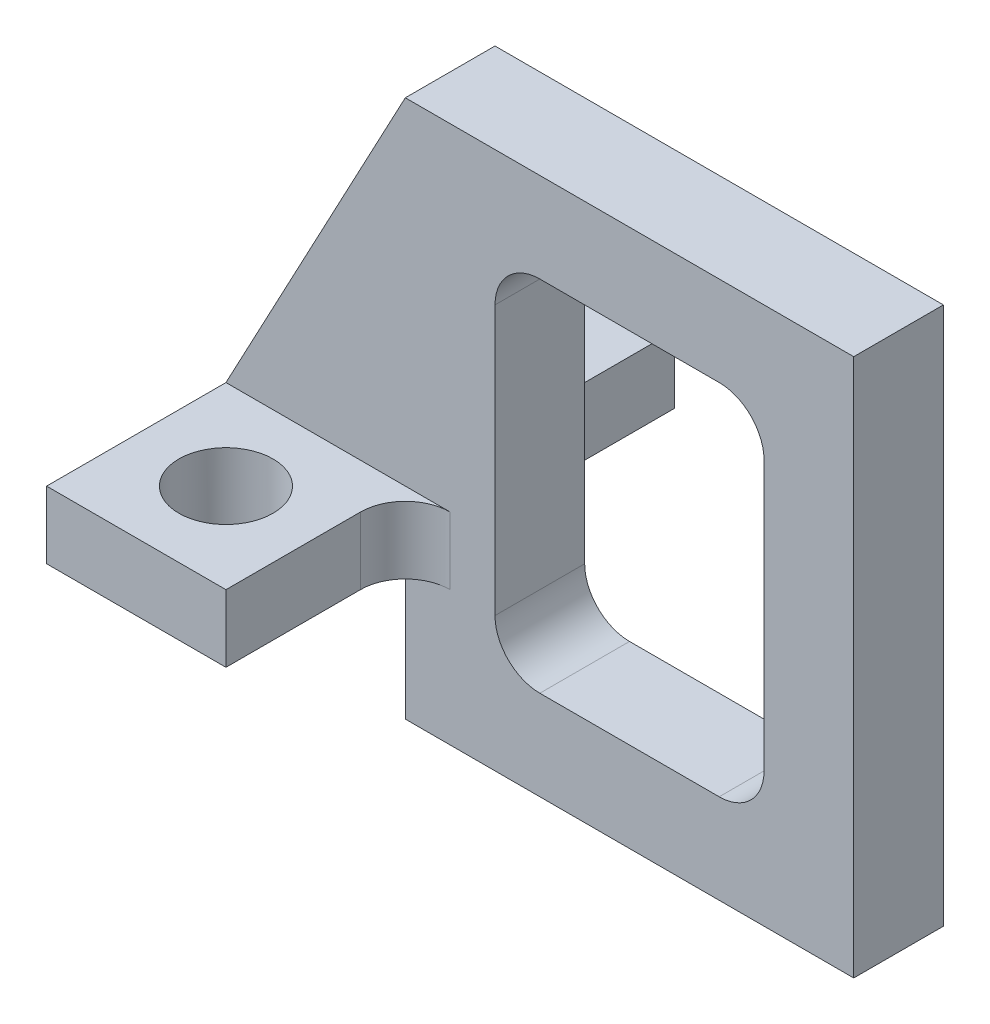
from build123d import *

# Parameters (mm, degrees)
SKETCH_1_W          = 20
SKETCH_1_H          = 24
SKETCH_1_W_2        = 12
SKETCH_1_H_2        = 16
EXTRUDE_1_DEPTH     = 4
SKETCH_2_W          = 20
SKETCH_2_H          = 3
EXTRUDE_2_DEPTH     = 8
EXTRUDE_3_DEPTH     = 4
SKETCH_4_R          = 2.1
CUT_EXTRUDE_1_DEPTH = 26
FILLET_1_R          = 2
FILLET_4_R          = 2


with BuildPart() as part:
    # 草图1 → 凸台-拉伸1 (new body)
    with BuildSketch(Plane.XY):
        with Locations((6, 8)):
            Rectangle(SKETCH_1_W, SKETCH_1_H)
        with Locations((6, 8)):
            Rectangle(SKETCH_1_W_2, SKETCH_1_H_2, mode=Mode.SUBTRACT)
    extrude(amount=EXTRUDE_1_DEPTH)

    # 草图2 → 凸台-拉伸2 (add)
    with BuildSketch(Plane.ZY.offset(4)):
        with Locations((2, 3.5)):
            Rectangle(SKETCH_2_W, SKETCH_2_H)
    extrude(amount=EXTRUDE_2_DEPTH)

    # 草图3 → 凸台-拉伸3 (add)
    with BuildSketch(Plane.XY.offset(4)):
        Polygon((-12, 5), (-4, 20), (-4, 5), align=None)
    extrude(amount=-EXTRUDE_3_DEPTH)

    # 草图4 → 切除-拉伸1 (cut, through all)
    with BuildSketch(Plane(origin=(0, 5, 0), x_dir=(1, 0, 0), z_dir=(0, 1, 0))):
        with Locations(Location((-8, 4, 0), (0, 0, 270))):
            Circle(SKETCH_4_R)
        with Locations(Location((-8, -8, 0), (0, 0, 270))):
            Circle(SKETCH_4_R)
    extrude(amount=-CUT_EXTRUDE_1_DEPTH, mode=Mode.SUBTRACT)

    # 圆角1
    fillet_1_edges = [part.edges().sort_by_distance(p)[0] for p in [
        (0, 16, 2),
        (0, 0, 2),
        (12, 0, 2),
        (12, 16, 2),
    ]]
    fillet(fillet_1_edges, radius=FILLET_1_R)

    # 圆角4
    fillet_4_edges = [part.edges().sort_by_distance(p)[0] for p in [
        (-4, 3.5, 0),
        (-4, 3.5, 4),
    ]]
    fillet(fillet_4_edges, radius=FILLET_4_R)


solid = part.part
